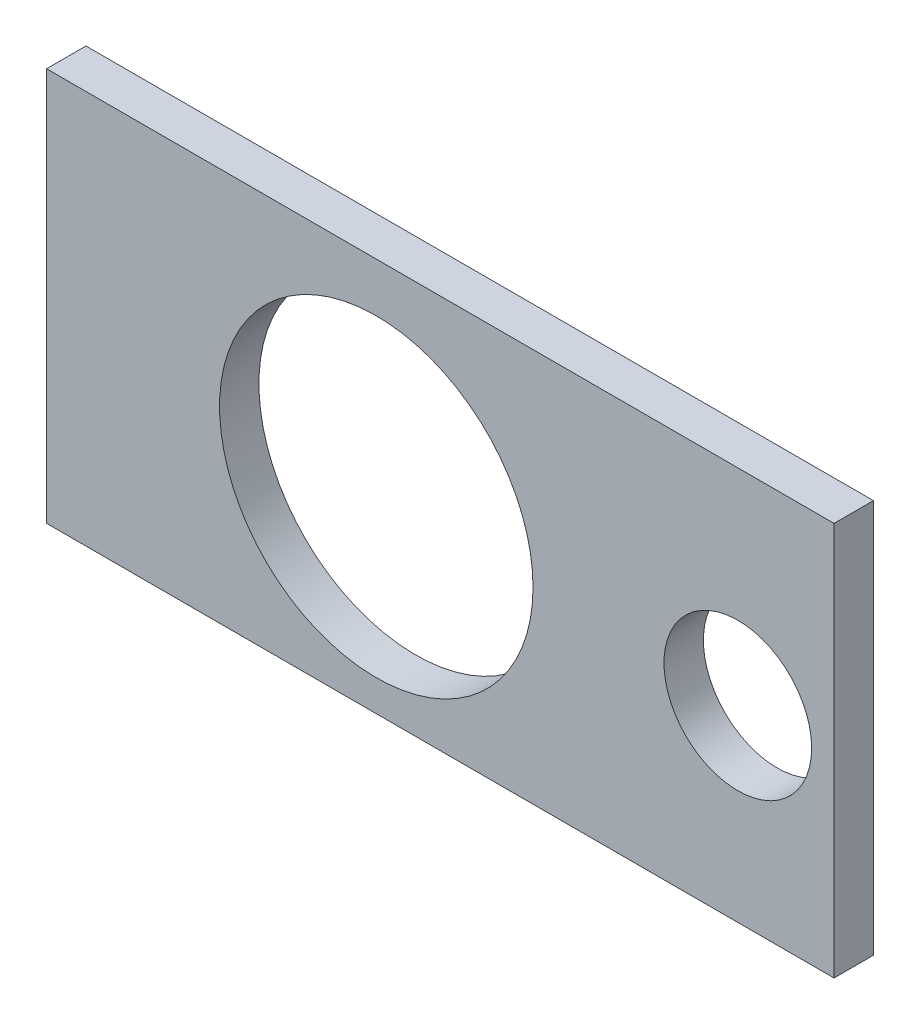
from build123d import *

# Parameters (mm, degrees)
SKETCH1_W           = 50.8
SKETCH1_H           = 25.4
SKETCH1_R           = 10.11134878
SKETCH1_R_2         = 4.7625
BOSS_EXTRUDE1_DEPTH = 2.54


with BuildPart() as part:
    # Sketch1 → Boss-Extrude1 (new body)
    with BuildSketch(Plane.XY):
        with Locations((-5.626058632, 0.579153094)):
            Rectangle(SKETCH1_W, SKETCH1_H)
        with Locations((-9.75581529, 0)):
            Circle(SKETCH1_R, mode=Mode.SUBTRACT)
        with Locations((13.566761816, 0)):
            Circle(SKETCH1_R_2, mode=Mode.SUBTRACT)
    extrude(amount=-BOSS_EXTRUDE1_DEPTH)


solid = part.part
